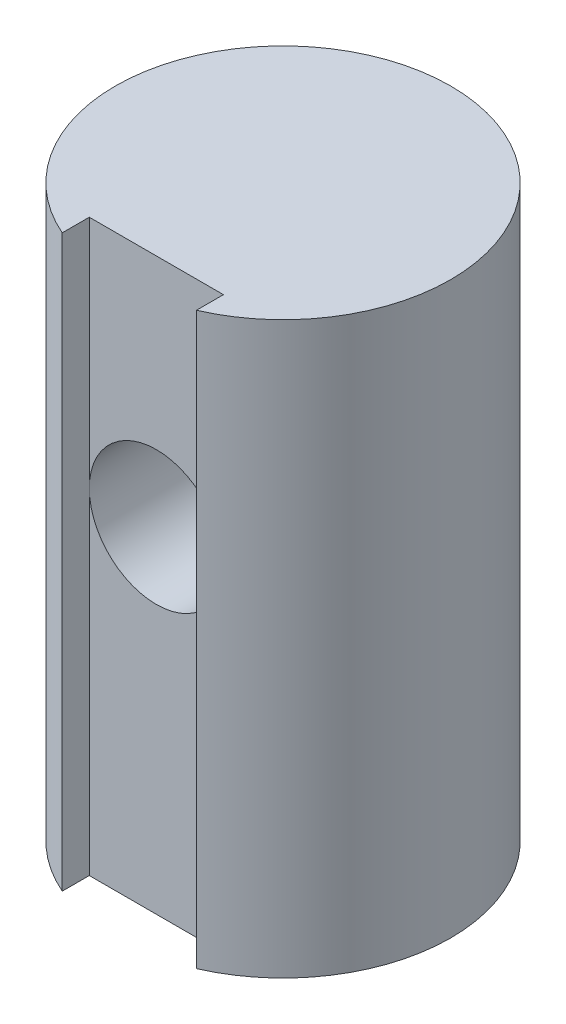
from build123d import *

# Parameters (mm, degrees)
SKETCH1_R           = 15.875
CYLINDER_DEPTH      = 53.975
SKETCH2_W           = 12.7
SKETCH2_H           = 3.8862
FLUE_TRACK_DEPTH    = 76.2
AIR_DUCT_DEPTH      = 59.45794963
AIR_DUCT_DEPTH_BACK = 59.45794963
SKETCH3_R           = 6.35


with BuildPart() as part:
    # Sketch1 → cylinder (new body)
    with BuildSketch(Plane(origin=(0, 0, 0), x_dir=(1, 0, 0), z_dir=(0, 1, 0))):
        with Locations(Location((0, 0, 0), (0, 0, 270))):
            Circle(SKETCH1_R)
    extrude(amount=CYLINDER_DEPTH)

    # Sketch2 → flue track (cut)
    with BuildSketch(Plane(origin=(0, 53.975, 0), x_dir=(1, 0, 0), z_dir=(0, 1, 0))):
        with Locations((0, -13.9319)):
            Rectangle(SKETCH2_W, SKETCH2_H)
    extrude(amount=-FLUE_TRACK_DEPTH, mode=Mode.SUBTRACT)

    # Sketch3 → air duct (cut, two sides: drawn at the far end of the back side and taken through both)
    with BuildSketch(Plane.XY.offset(-AIR_DUCT_DEPTH_BACK)):
        with Locations((0, 31.75)):
            Circle(SKETCH3_R)
    extrude(amount=AIR_DUCT_DEPTH + AIR_DUCT_DEPTH_BACK, mode=Mode.SUBTRACT)


solid = part.part
